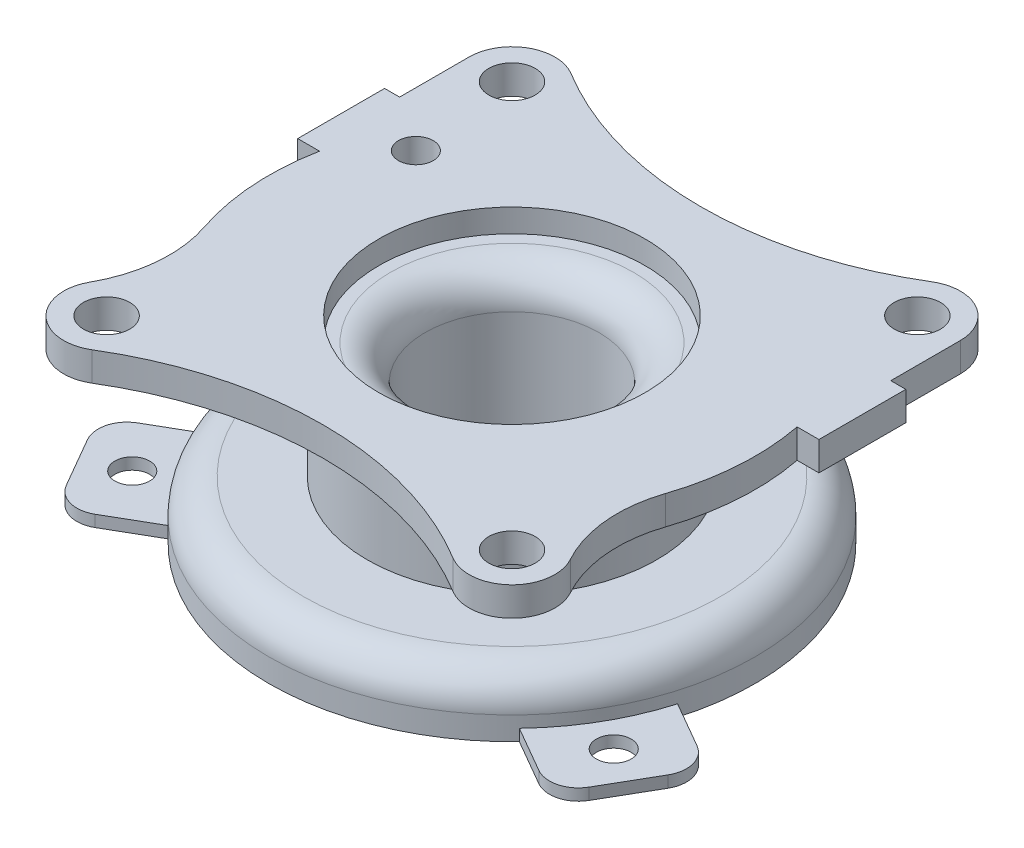
from build123d import *

# Parameters (mm, degrees)
BOSS_EXTRUDE1_START = 2
SKETCH2_R           = 3
BOSS_EXTRUDE1_DEPTH = 2
CIRPATTERN1_COUNT   = 3
HOLE3_D             = 30
HOLE3_CBORE_D       = 46
HOLE3_CBORE_DEPTH   = 4
FILLET1_R           = 6
SKETCH9_R           = 30
SKETCH9_R_2         = 4
BOSS_EXTRUDE2_DEPTH = 5
HOLE4_D             = 6
HOLE4_DEPTH         = 5


with BuildPart() as part:
    # Sketch1 → Revolve1 (revolve)
    with BuildSketch(Plane.XY, mode=Mode.PRIVATE) as revolve1_sk:
        Polygon((0, 0), (0, 10), (17, 10), (17, 30), (12, 30), (12, 34), (42, 34), (42, 0), align=None)
    revolve(revolve1_sk.sketch.rotate(Axis((42, 34, 0), (0, -1, 0)), 270), axis=Axis((42, 34, 0), (0, -1, 0)))

    # Sketch2 → Boss-Extrude1 (add)
    with BuildSketch(Plane(origin=(0, 0, 0), x_dir=(1, 0, 0), z_dir=(0, 1, 0)).offset(BOSS_EXTRUDE1_START)):
        with BuildLine():
            Line((37, 55), (47, 55))
            ThreePointArc((47, 55), (50.535533906, 53.535533906), (52, 50))
            Line((52, 50), (52, 40.792156109))
            ThreePointArc((52, 40.792156109), (42, 42), (32, 40.792156109))
            Line((32, 40.792156109), (32, 50))
            ThreePointArc((32, 50), (33.464466094, 53.535533906), (37, 55))
        make_face()
        with Locations(Location((42, 48, 0), (0, 0, 270))):
            Circle(SKETCH2_R, mode=Mode.SUBTRACT)
    boss_extrude1 = extrude(amount=-BOSS_EXTRUDE1_DEPTH)

    # CirPattern1: Boss-Extrude1 ×3 about axis
    cirpattern1_axis = Axis((42, 0, 0), (0, 1, 0))
    for i in range(1, CIRPATTERN1_COUNT):
        add(boss_extrude1.rotate(cirpattern1_axis, i * 360 / CIRPATTERN1_COUNT))

    # Hole3 (through all)
    with Locations(Plane(origin=(0, 34, 0), x_dir=(1, 0, 0), z_dir=(0, 1, 0))):
        with Locations((42, 0)):
            CounterBoreHole(HOLE3_D / 2, HOLE3_CBORE_D / 2, HOLE3_CBORE_DEPTH)

    # Fillet1
    fillet1_edges = [part.edges().sort_by_distance(p)[0] for p in [
        (57, 30, 0),
        (42, 10, -42),
    ]]
    fillet(fillet1_edges, radius=FILLET1_R)

    # Sketch9 → Boss-Extrude2 (add)
    with BuildSketch(Plane(origin=(0, 34, 0), x_dir=(1, 0, 0), z_dir=(0, 1, 0))):
        with BuildLine():
            Line((84.405889748, 35), (84.405889748, 23))
            Line((84.405889748, 23), (87, 23))
            Line((87, 23), (87, 8))
            Line((87, 8), (83.231056256, 8))
            ThreePointArc((83.231056256, 8), (83.908844823, -2.76563295), (81.822211706, -13.348837209))
            ThreePointArc((81.822211706, -13.348837209), (80.749412141, -22.553158791), (83.47715359, -31.409222322))
            ThreePointArc((83.47715359, -31.409222322), (82.131599646, -40.339839701), (73.15454759, -41.329273159))
            ThreePointArc((73.15454759, -41.329273159), (42, -32.606891712), (10.84545241, -41.329273159))
            ThreePointArc((10.84545241, -41.329273159), (1.868400354, -40.339839701), (0.52284641, -31.409222322))
            ThreePointArc((0.52284641, -31.409222322), (3.250587859, -22.553158791), (2.177788294, -13.348837209))
            ThreePointArc((2.177788294, -13.348837209), (0.091155177, -2.76563295), (0.768943744, 8))
            Line((0.768943744, 8), (-3, 8))
            Line((-3, 8), (-3, 23))
            Line((-3, 23), (-0.405889748, 23))
            Line((-0.405889748, 23), (-0.405889748, 35))
            ThreePointArc((-0.405889748, 35), (3.369007961, 41.454695947), (10.84545241, 41.329273159))
            ThreePointArc((10.84545241, 41.329273159), (42, 32.606891712), (73.15454759, 41.329273159))
            ThreePointArc((73.15454759, 41.329273159), (80.630992039, 41.454695947), (84.405889748, 35))
        make_face()
        with Locations(Location((42, 0, 0), (0, 0, 270))):
            Circle(SKETCH9_R, mode=Mode.SUBTRACT)
        with Locations(Location((77, 35, 0), (0, 0, 270))):
            Circle(SKETCH9_R_2, mode=Mode.SUBTRACT)
        with Locations(Location((77, -35, 0), (0, 0, 270))):
            Circle(SKETCH9_R_2, mode=Mode.SUBTRACT)
        with Locations(Location((7, -35, 0), (0, 0, 270))):
            Circle(SKETCH9_R_2, mode=Mode.SUBTRACT)
        with Locations(Location((7, 35, 0), (0, 0, 270))):
            Circle(SKETCH9_R_2, mode=Mode.SUBTRACT)
    extrude(amount=-BOSS_EXTRUDE2_DEPTH)

    # Hole4
    with Locations(Plane(origin=(0, 34, 0), x_dir=(1, 0, 0), z_dir=(0, 1, 0))):
        with Locations((9, 16.4)):
            Hole(HOLE4_D / 2, depth=HOLE4_DEPTH)


solid = part.part
